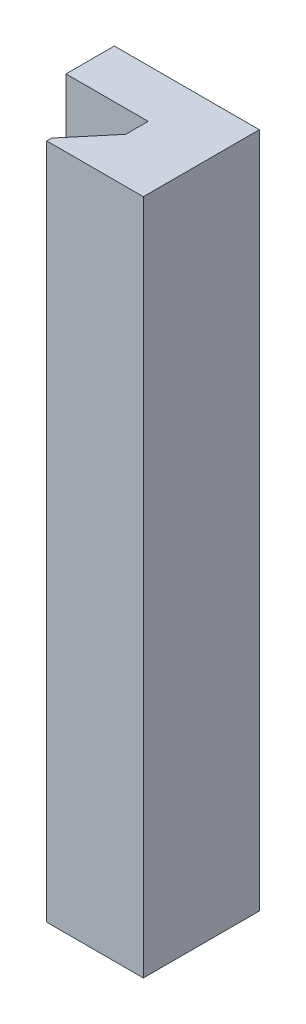
from build123d import *

# Parameters (mm, degrees)
SKETCH_1_W          = 35
SKETCH_1_H          = 70
EXTRUDE_1_DEPTH     = 12
CUT_EXTRUDE_1_REACH = 81.177
SKETCH_3_W          = 20
SKETCH_3_H          = 70
CUT_EXTRUDE_2_DEPTH = 79.574805122


with BuildPart() as part:
    # 草图1 → 凸台-拉伸1 (new body)
    with BuildSketch(Plane.XY):
        with Locations((17.5, -35)):
            Rectangle(SKETCH_1_W, SKETCH_1_H)
    extrude(amount=EXTRUDE_1_DEPTH)

    # 草图2 → 切除-拉伸1 (cut, up to next)
    with BuildSketch(Plane.XZ.offset(70), mode=Mode.PRIVATE) as cut_extrude_1_sk1:
        Polygon((28.5, 7.328862426), (28.5, 5), (0, 5), (0, 12), (25, 12), (25, 11.5), align=None)
    cut_extrude_1_tool1 = extrude(cut_extrude_1_sk1.sketch, amount=-CUT_EXTRUDE_1_REACH, mode=Mode.PRIVATE) & part.part
    add(cut_extrude_1_tool1.solids().sort_by_distance((13.633689, -70, 8.408444))[0], mode=Mode.SUBTRACT)

    # 草图3 → 切除-拉伸2 (cut, through all)
    with BuildSketch(Plane.XY.offset(5)):
        with Locations((10, -35)):
            Rectangle(SKETCH_3_W, SKETCH_3_H)
    extrude(amount=-CUT_EXTRUDE_2_DEPTH, mode=Mode.SUBTRACT)


solid = part.part
